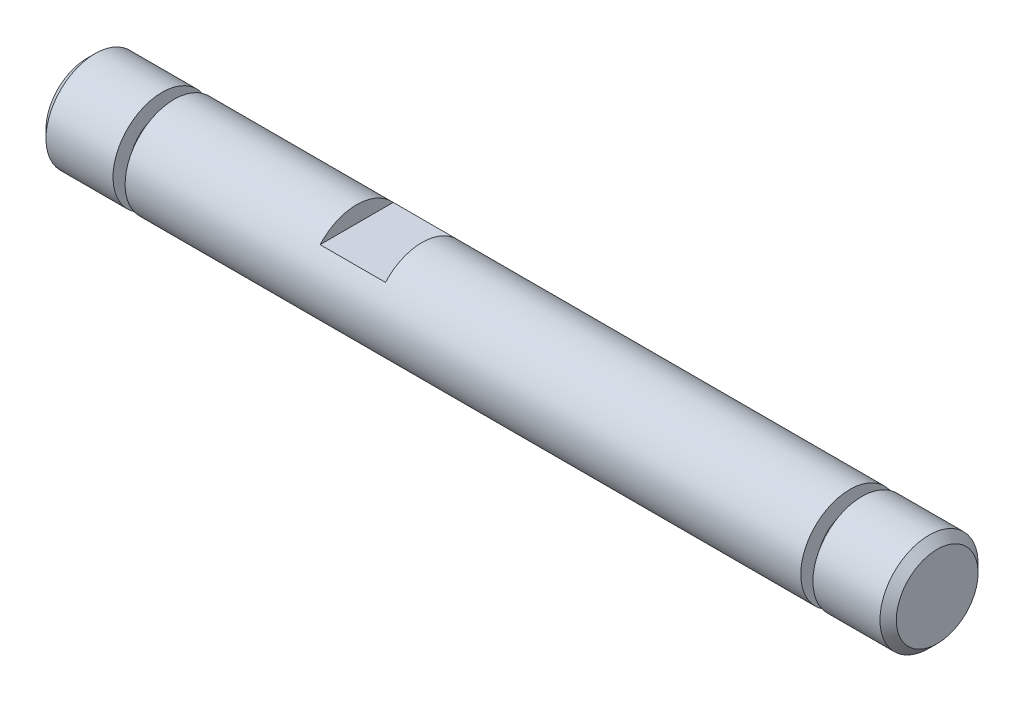
from build123d import *

# Parameters (mm, degrees)
ESQUISSE1_W                  = 52
ESQUISSE1_H                  = 3
CHANFREIN1_SIZE              = 0.5
ENL_V_MAT_EXTRU_1_DEPTH      = 27.343879745
ENL_V_MAT_EXTRU_1_DEPTH_BACK = 27.343879745
ESQUISSE2_W                  = 4
ESQUISSE2_H                  = 2
ESQUISSE3_W                  = 0.74
ESQUISSE3_H                  = 1


with BuildPart() as part:
    # Esquisse1 → Révolution1 (revolve)
    with BuildSketch(Plane.XY, mode=Mode.PRIVATE) as r_volution1_sk:
        with Locations((0, 1.5)):
            Rectangle(ESQUISSE1_W, ESQUISSE1_H)
    revolve(r_volution1_sk.sketch.rotate(Axis((0, 0, 0), (1, 0, 0)), 90), axis=Axis((0, 0, 0), (1, 0, 0)))

    # Chanfrein1
    chanfrein1_edges = [part.edges().sort_by_distance(p)[0] for p in [
        (26, 0, -3),
        (-26, 0, -3),
    ]]
    chamfer(chanfrein1_edges, length=CHANFREIN1_SIZE)

    # Esquisse2 → Enlèv. mat.-Extru.1 (cut, two sides: drawn at the far end of the back side and taken through both)
    with BuildSketch(Plane.XY.offset(-ENL_V_MAT_EXTRU_1_DEPTH_BACK)):
        with Locations((-7.5, 3)):
            Rectangle(ESQUISSE2_W, ESQUISSE2_H)
    extrude(amount=ENL_V_MAT_EXTRU_1_DEPTH + ENL_V_MAT_EXTRU_1_DEPTH_BACK, mode=Mode.SUBTRACT)

    # Esquisse3 → Enlèvement de matière-Révolution1 (revolve, cut)
    with BuildSketch(Plane.XY):
        with Locations((-21.03, 2.5)):
            Rectangle(ESQUISSE3_W, ESQUISSE3_H)
        with Locations((21.03, 2.5)):
            Rectangle(ESQUISSE3_W, ESQUISSE3_H)
    revolve(axis=Axis((0, 0, 0), (-1, 0, 0)), mode=Mode.SUBTRACT)


solid = part.part
